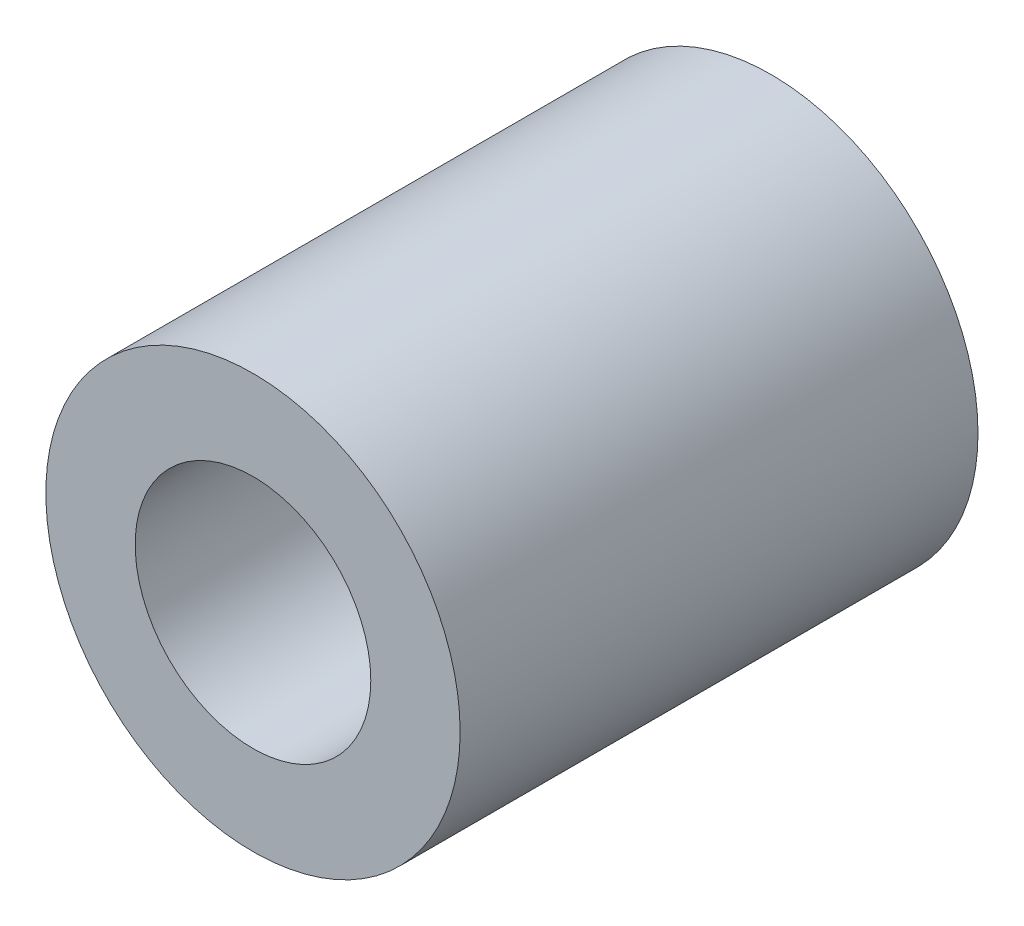
from build123d import *

# Parameters (mm, degrees)
SKETCH1_R           = 4
SKETCH1_R_2         = 2.275
BOSS_EXTRUDE1_DEPTH = 10


with BuildPart() as part:
    # Sketch1 → Boss-Extrude1 (new body)
    with BuildSketch(Plane.XY):
        Circle(SKETCH1_R)
        Circle(SKETCH1_R_2, mode=Mode.SUBTRACT)
    extrude(amount=BOSS_EXTRUDE1_DEPTH)


solid = part.part
